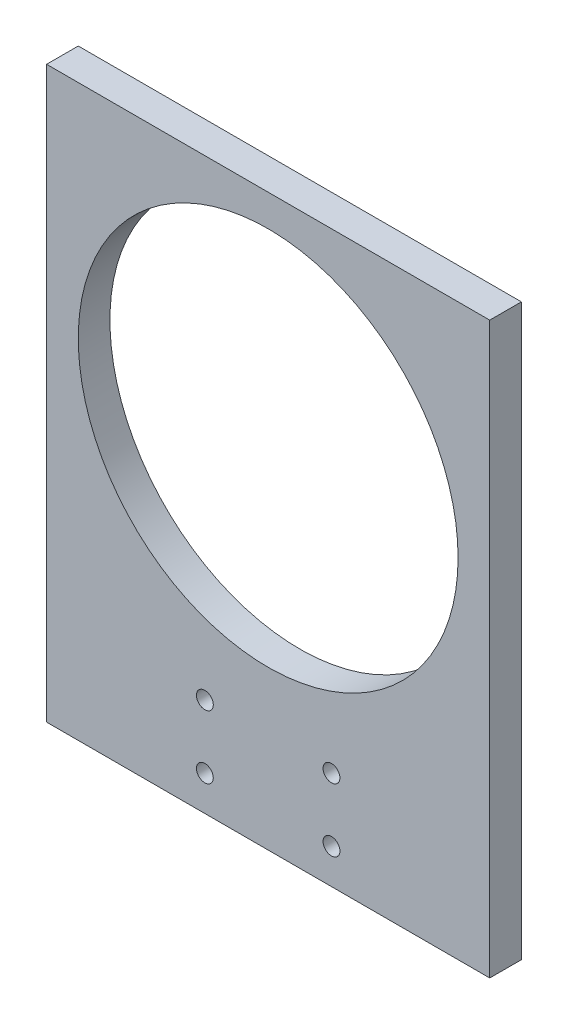
from build123d import *

# Parameters (mm, degrees)
SKETCH1_W           = 177.8
SKETCH1_H           = 228.6
SKETCH1_R           = 76.2
SKETCH1_R_2         = 3.3782
BOSS_EXTRUDE3_DEPTH = 12.7


with BuildPart() as part:
    # Sketch1 → Boss-Extrude3 (new body)
    with BuildSketch(Plane.XY):
        with Locations((88.9, 114.3)):
            Rectangle(SKETCH1_W, SKETCH1_H)
        with Locations((88.9, 139.7)):
            Circle(SKETCH1_R, mode=Mode.SUBTRACT)
        with Locations((63.5, 14.036283171)):
            Circle(SKETCH1_R_2, mode=Mode.SUBTRACT)
        with Locations((63.5, 39.436283171)):
            Circle(SKETCH1_R_2, mode=Mode.SUBTRACT)
        with Locations(Location((114.3, 14.036283171, 0), (0, 0, 180))):
            Circle(SKETCH1_R_2, mode=Mode.SUBTRACT)
        with Locations(Location((114.3, 39.436283171, 0), (0, 0, 180))):
            Circle(SKETCH1_R_2, mode=Mode.SUBTRACT)
    extrude(amount=BOSS_EXTRUDE3_DEPTH)


solid = part.part
